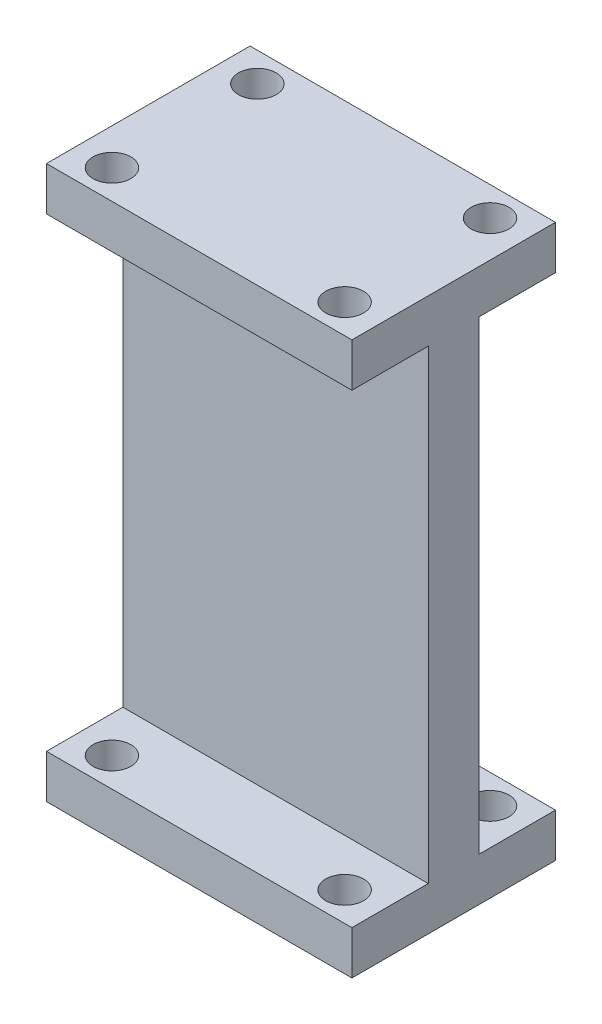
from build123d import *

# Parameters (mm, degrees)
SKETCH3_W           = 21
SKETCH3_H           = 14
SKETCH3_R           = 1.3
BOSS_EXTRUDE1_DEPTH = 3
SKETCH4_W           = 21
SKETCH4_H           = 3.5
BOSS_EXTRUDE2_DEPTH = 32
SKETCH5_W           = 21
SKETCH5_H           = 14
SKETCH5_R           = 1.3
BOSS_EXTRUDE3_DEPTH = 3


with BuildPart() as part:
    # Sketch3 → Boss-Extrude1 (new body)
    with BuildSketch(Plane(origin=(0, 0, 0), x_dir=(1, 0, 0), z_dir=(0, 1, 0))):
        Rectangle(SKETCH3_W, SKETCH3_H)
        with Locations(Location((-8, -5, 0), (0, 0, 270))):
            Circle(SKETCH3_R, mode=Mode.SUBTRACT)
        with Locations(Location((8, -5, 0), (0, 0, 270))):
            Circle(SKETCH3_R, mode=Mode.SUBTRACT)
        with Locations(Location((8, 5, 0), (0, 0, 90))):
            Circle(SKETCH3_R, mode=Mode.SUBTRACT)
        with Locations(Location((-8, 5, 0), (0, 0, 90))):
            Circle(SKETCH3_R, mode=Mode.SUBTRACT)
    extrude(amount=BOSS_EXTRUDE1_DEPTH)

    # Sketch4 → Boss-Extrude2 (add)
    with BuildSketch(Plane(origin=(0, 3, 0), x_dir=(1, 0, 0), z_dir=(0, 1, 0))):
        Rectangle(SKETCH4_W, SKETCH4_H)
    extrude(amount=BOSS_EXTRUDE2_DEPTH)

    # Sketch5 → Boss-Extrude3 (add)
    with BuildSketch(Plane(origin=(0, 35, 0), x_dir=(1, 0, 0), z_dir=(0, 1, 0))):
        Rectangle(SKETCH5_W, SKETCH5_H)
        with Locations(Location((-8, -5, 0), (0, 0, 270))):
            Circle(SKETCH5_R, mode=Mode.SUBTRACT)
        with Locations(Location((-8, 5, 0), (0, 0, 90))):
            Circle(SKETCH5_R, mode=Mode.SUBTRACT)
        with Locations(Location((8, 5, 0), (0, 0, 90))):
            Circle(SKETCH5_R, mode=Mode.SUBTRACT)
        with Locations(Location((8, -5, 0), (0, 0, 270))):
            Circle(SKETCH5_R, mode=Mode.SUBTRACT)
    extrude(amount=BOSS_EXTRUDE3_DEPTH)


solid = part.part
